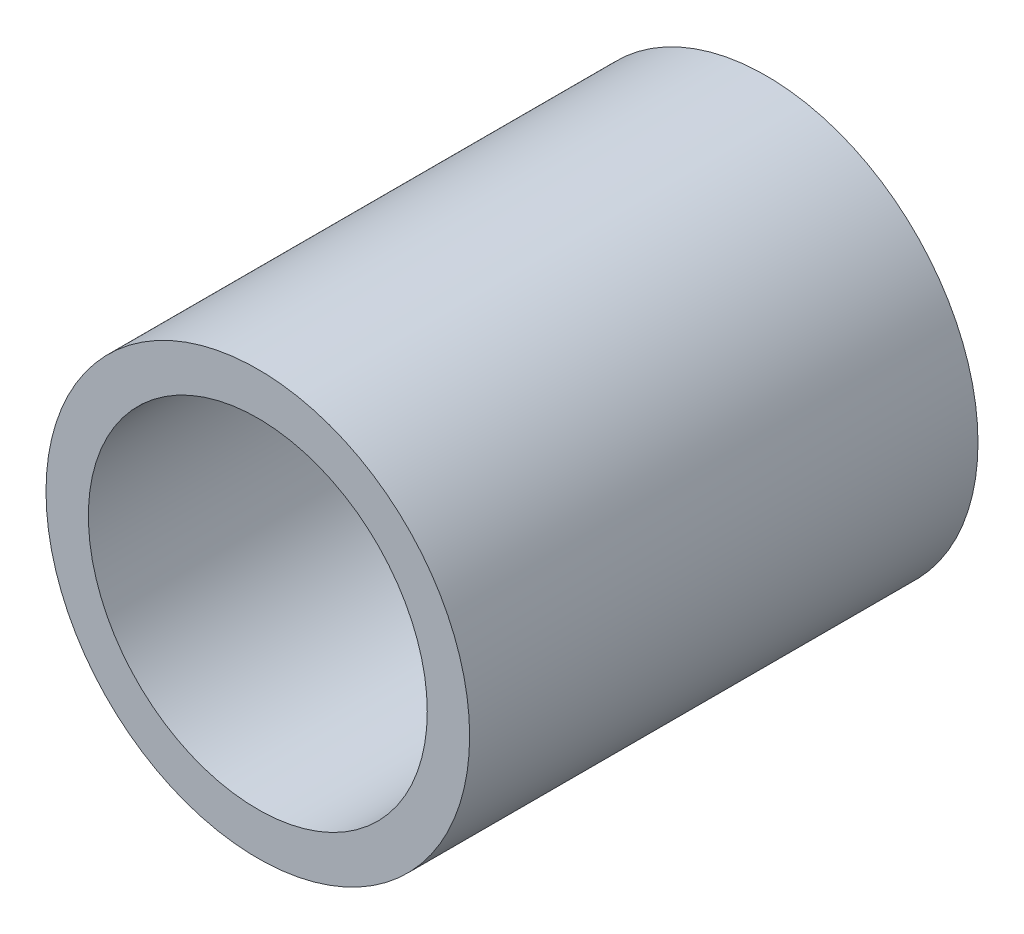
from build123d import *

# Parameters (mm, degrees)
SKETCH_1_R      = 12.5
SKETCH_1_R_2    = 10
EXTRUDE_1_DEPTH = 15


with BuildPart() as part:
    # 草图1 → 凸台-拉伸1 (new, symmetric)
    with BuildSketch(Plane.XY):
        Circle(SKETCH_1_R)
        Circle(SKETCH_1_R_2, mode=Mode.SUBTRACT)
    extrude(amount=EXTRUDE_1_DEPTH, both=True)


solid = part.part
